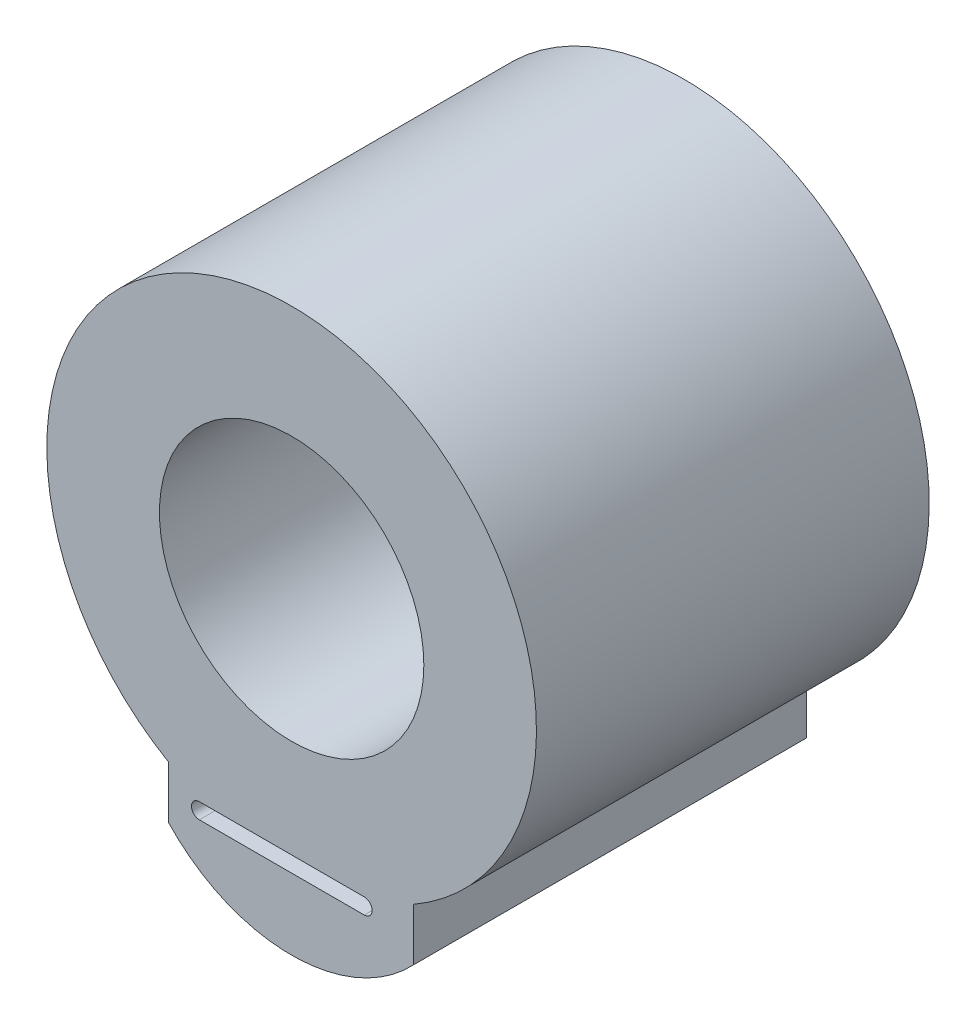
from build123d import *

# Parameters (mm, degrees)
SKETCH1_R               = 12.824135806
BOSS_EXTRUDE2_DEPTH     = 38.1
CUT_EXTRUDE1_DEPTH      = 35
CUT_EXTRUDE2_DEPTH      = 23.57
CUT_EXTRUDE2_DEPTH_BACK = 23.57
SKETCH6_R               = 8


with BuildPart() as part:
    # Sketch1 → Boss-Extrude2 (new body)
    with BuildSketch(Plane.XY):
        with BuildLine():
            Line((11.842048876, -25.66709252), (11.842048876, -20.58709252))
            ThreePointArc((11.842048876, -20.58709252), (0.061981133, 23.749919123), (-11.94934079, -20.525003159))
            Line((-11.94934079, -20.525003159), (-11.94934079, -25.605003159))
            ThreePointArc((-11.94934079, -25.605003159), (-0.067090695, -30.787800341), (11.842048876, -25.66709252))
        make_face()
        Circle(SKETCH1_R, mode=Mode.SUBTRACT)
    extrude(amount=BOSS_EXTRUDE2_DEPTH)

    # Sketch3 → Cut-Extrude1 (cut)
    with BuildSketch(Plane.XY.offset(38.1)):
        with BuildLine():
            Line((-8.95388159, -22.363138181), (7.04611841, -22.363138181))
            ThreePointArc((7.04611841, -22.363138181), (7.80811841, -23.125138181), (7.04611841, -23.887138181))
            Line((7.04611841, -23.887138181), (-8.95388159, -23.887138181))
            ThreePointArc((-8.95388159, -23.887138181), (-9.71588159, -23.125138181), (-8.95388159, -22.363138181))
        make_face()
    extrude(amount=-CUT_EXTRUDE1_DEPTH, mode=Mode.SUBTRACT)

    # Sketch6 → Cut-Extrude2 (cut, two sides: drawn at the far end of the back side and taken through both)
    with BuildSketch(Plane(origin=(0, -23.887138181, 0), x_dir=(1, 0, 0), z_dir=(0, 1, 0)).offset(-CUT_EXTRUDE2_DEPTH_BACK)):
        with Locations((0, -9.09196145)):
            Circle(SKETCH6_R)
    extrude(amount=CUT_EXTRUDE2_DEPTH + CUT_EXTRUDE2_DEPTH_BACK, mode=Mode.SUBTRACT)


solid = part.part
